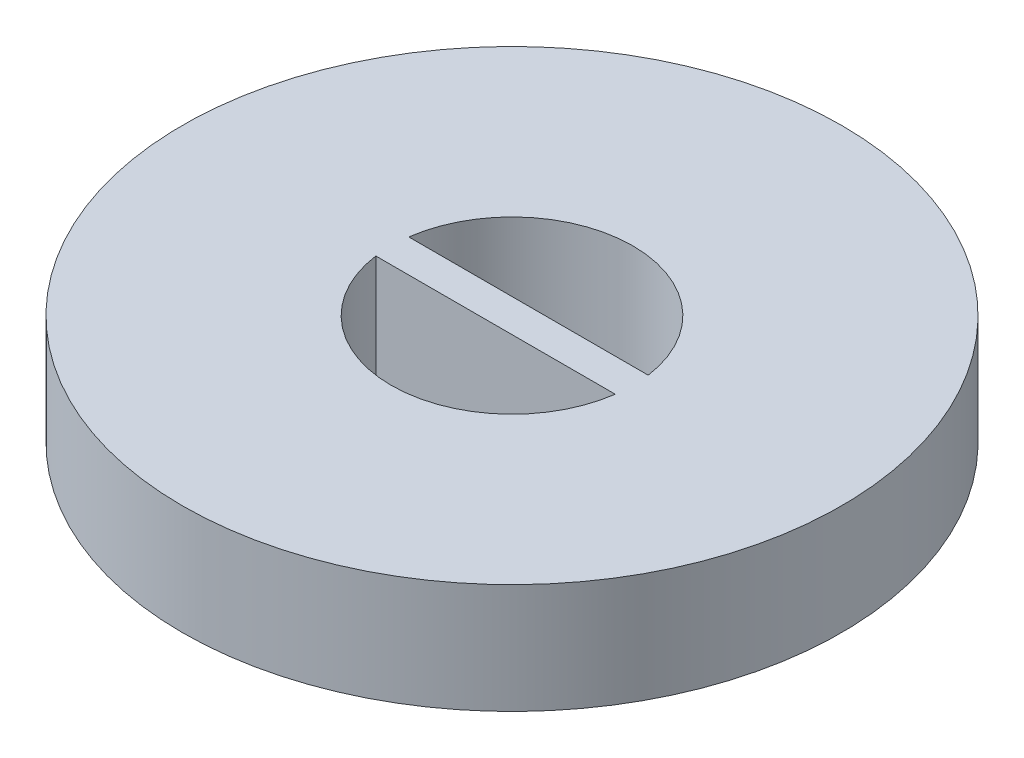
from build123d import *

# Parameters (mm, degrees)
SKETCH2_R           = 6
BOSS_EXTRUDE1_DEPTH = 2
CUT_EXTRUDE3_DEPTH  = 4


with BuildPart() as part:
    # Sketch2 → Boss-Extrude1 (new body)
    with BuildSketch(Plane(origin=(0, 0, 0), x_dir=(1, 0, 0), z_dir=(0, 1, 0))):
        with Locations(Location((0, 0, 0), (0, 0, 270))):
            Circle(SKETCH2_R)
    extrude(amount=BOSS_EXTRUDE1_DEPTH)

    # Sketch3 → Cut-Extrude3 (cut)
    with BuildSketch(Plane(origin=(0, 2, 0), x_dir=(1, 0, 0), z_dir=(0, 1, 0))):
        with BuildLine():
            Line((-2.179449472, 0.3), (0, 0.3))
            Line((0, 0.3), (2.179449472, 0.3))
            ThreePointArc((2.179449472, 0.3), (0, 2.2), (-2.179449472, 0.3))
        make_face()
        with BuildLine():
            Line((2.179449472, -0.3), (0, -0.3))
            Line((0, -0.3), (-2.179449472, -0.3))
            ThreePointArc((-2.179449472, -0.3), (0, -2.2), (2.179449472, -0.3))
        make_face()
    extrude(amount=-CUT_EXTRUDE3_DEPTH, mode=Mode.SUBTRACT)


solid = part.part
